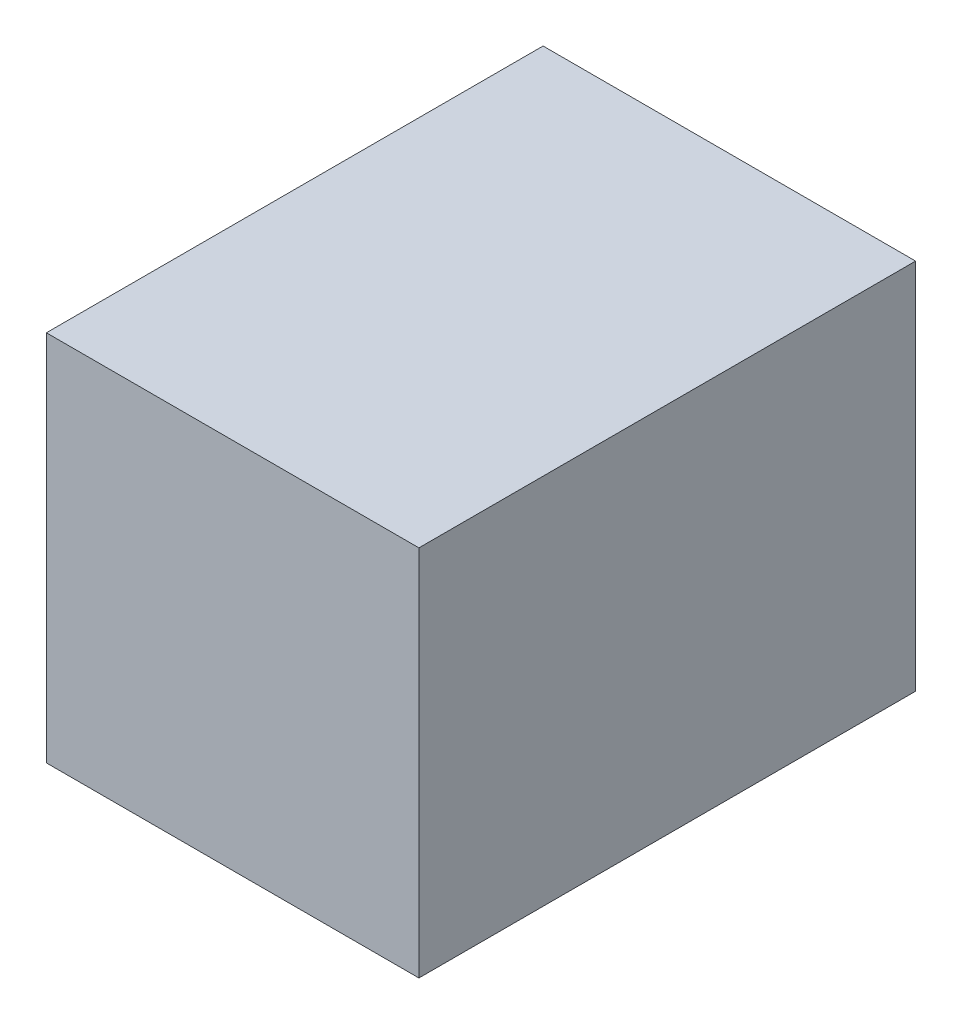
from build123d import *

# Parameters (mm, degrees)
SKETCH1_W           = 1500
SKETCH1_H           = 2000
BOSS_EXTRUDE1_DEPTH = 1500


with BuildPart() as part:
    # Sketch1 → Boss-Extrude1 (new body)
    with BuildSketch(Plane(origin=(0, 0, 0), x_dir=(1, 0, 0), z_dir=(0, 1, 0))):
        Rectangle(SKETCH1_W, SKETCH1_H)
    extrude(amount=BOSS_EXTRUDE1_DEPTH)


solid = part.part
